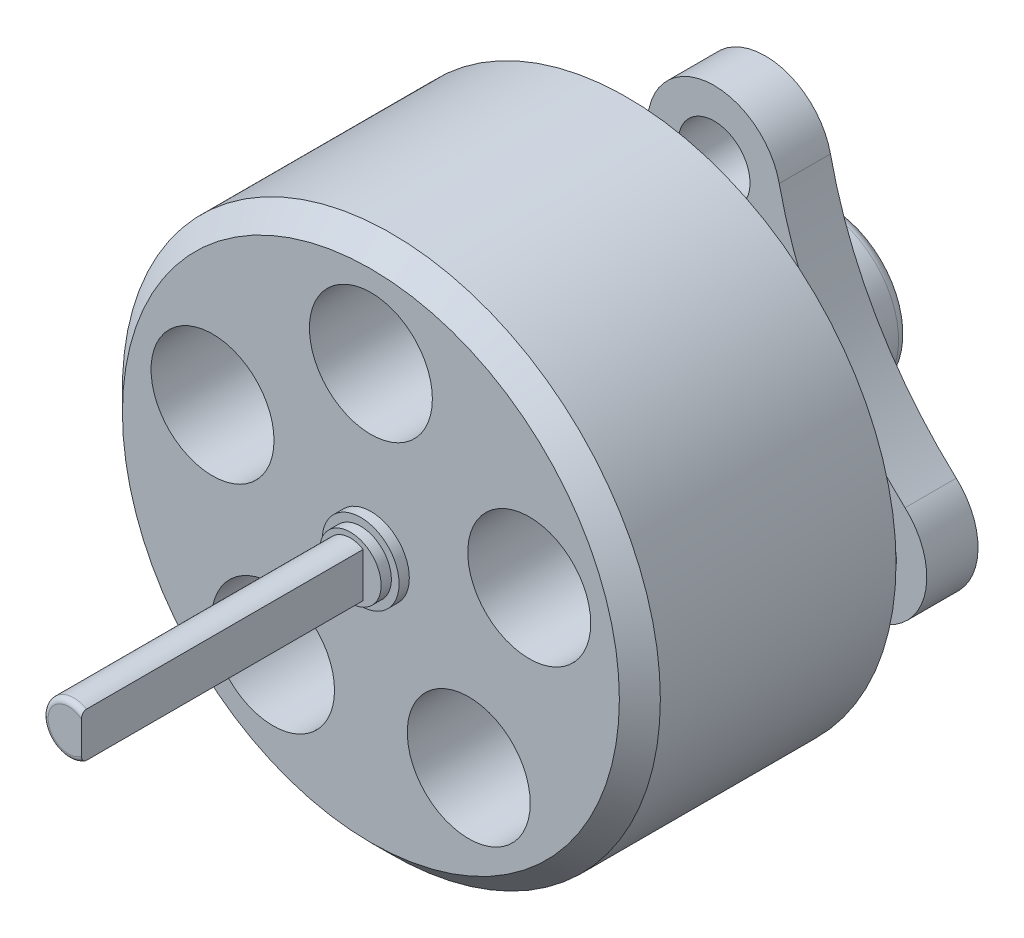
from build123d import *

# Parameters (mm, degrees)
SKETCH_1_R          = 5.25
EXTRUDE_1_DEPTH     = 5
CHAMFER_1_SIZE      = 0.4
SKETCH_2_R          = 1.2
CUT_EXTRUDE_1_DEPTH = 2.5
SKETCH_3_R          = 0.75
EXTRUDE_2_DEPTH     = 0.2
SKETCH_4_R          = 0.6
EXTRUDE_3_DEPTH     = 0.2
SKETCH_5_R          = 0.5
EXTRUDE_4_DEPTH     = 5.5
FILLET_1_R          = 0.1
SKETCH_6_R          = 2.5
EXTRUDE_5_DEPTH     = 1.7
EXTRUDE_6_DEPTH     = 1
SKETCH_8_R          = 0.7
CUT_EXTRUDE_2_DEPTH = 1
SKETCH_9_R          = 1.5
EXTRUDE_7_DEPTH     = 1.3
FILLET_2_R          = 0.2
CUT_EXTRUDE_3_DEPTH = 5.5


with BuildPart() as part:
    # 草图1 → 凸台-拉伸1 (new body)
    with BuildSketch(Plane.XY):
        Circle(SKETCH_1_R)
    extrude(amount=EXTRUDE_1_DEPTH)

    # 倒角1
    chamfer_1_edges = [part.edges().sort_by_distance(p)[0] for p in [
        (-5.25, 0, 5),
    ]]
    chamfer(chamfer_1_edges, length=CHAMFER_1_SIZE)

    # 草图2 → 切除-拉伸1 (cut)
    with BuildSketch(Plane.XY.offset(5)):
        with Locations((0, 3.25)):
            Circle(SKETCH_2_R)
        with Locations((3.090933678, 1.004305232)):
            Circle(SKETCH_2_R)
        with Locations((1.91030207, -2.629305232)):
            Circle(SKETCH_2_R)
        with Locations((-1.91030207, -2.629305232)):
            Circle(SKETCH_2_R)
        with Locations((-3.090933678, 1.004305232)):
            Circle(SKETCH_2_R)
    extrude(amount=-CUT_EXTRUDE_1_DEPTH, mode=Mode.SUBTRACT)

    # 草图3 → 凸台-拉伸2 (add)
    with BuildSketch(Plane.XY.offset(5)):
        Circle(SKETCH_3_R)
    extrude(amount=EXTRUDE_2_DEPTH)

    # 草图4 → 凸台-拉伸3 (add)
    with BuildSketch(Plane.XY.offset(5.2)):
        Circle(SKETCH_4_R)
    extrude(amount=EXTRUDE_3_DEPTH)

    # 草图5 → 凸台-拉伸4 (add)
    with BuildSketch(Plane.XY.offset(5.4)):
        Circle(SKETCH_5_R)
    extrude(amount=EXTRUDE_4_DEPTH)

    # 圆角1
    fillet_1_edges = [part.edges().sort_by_distance(p)[0] for p in [
        (-0.5, 0, 10.9),
    ]]
    fillet(fillet_1_edges, radius=FILLET_1_R)

    # 草图6 → 凸台-拉伸5 (add)
    with BuildSketch(Plane(origin=(0, 0, 0), x_dir=(-1, 0, 0), z_dir=(0, 0, -1))):
        Circle(SKETCH_6_R)
    extrude(amount=EXTRUDE_5_DEPTH)

    # 草图7 → 凸台-拉伸6 (add)
    with BuildSketch(Plane(origin=(0, 0, -1.7), x_dir=(-1, 0, 0), z_dir=(0, 0, -1))):
        with BuildLine():
            ThreePointArc((1.270195148, 3.576774791), (0, 4.6), (-1.270195148, 3.576774791))
            ThreePointArc((-1.270195148, 3.576774791), (-2.166553875, 1.259382495), (-3.725295111, -0.675583082))
            ThreePointArc((-3.725295111, -0.675583082), (-3.976336561, -2.287216952), (-2.455099963, -2.875625614))
            ThreePointArc((-2.455099963, -2.875625614), (0, -2.493198894), (2.455099963, -2.875625614))
            ThreePointArc((2.455099963, -2.875625614), (3.976336561, -2.287216952), (3.725295111, -0.675583082))
            ThreePointArc((3.725295111, -0.675583082), (2.166553875, 1.259382495), (1.270195148, 3.576774791))
        make_face()
    extrude(amount=EXTRUDE_6_DEPTH)

    # 草图8 → 切除-拉伸2 (cut)
    with BuildSketch(Plane(origin=(0, 0, -2.7), x_dir=(-1, 0, 0), z_dir=(0, 0, -1))):
        with Locations((0, 3.3)):
            Circle(SKETCH_8_R)
        with Locations((2.857883832, -1.65)):
            Circle(SKETCH_8_R)
        with Locations((-2.857883832, -1.65)):
            Circle(SKETCH_8_R)
    extrude(amount=-CUT_EXTRUDE_2_DEPTH, mode=Mode.SUBTRACT)

    # 草图9 → 凸台-拉伸7 (add)
    with BuildSketch(Plane(origin=(0, 0, -2.7), x_dir=(-1, 0, 0), z_dir=(0, 0, -1))):
        Circle(SKETCH_9_R)
    extrude(amount=EXTRUDE_7_DEPTH)

    # 圆角2
    fillet_2_edges = [part.edges().sort_by_distance(p)[0] for p in [
        (1.5, 0, -4),
    ]]
    fillet(fillet_2_edges, radius=FILLET_2_R)

    # 草图10 → 切除-拉伸3 (cut)
    with BuildSketch(Plane.XY.offset(10.9)):
        with BuildLine():
            Line((0.25, 0.441561144), (0.25, -0.441561144))
            ThreePointArc((0.25, -0.441561144), (0.50742117, 0), (0.25, 0.441561144))
        make_face()
    extrude(amount=-CUT_EXTRUDE_3_DEPTH, mode=Mode.SUBTRACT)


solid = part.part
